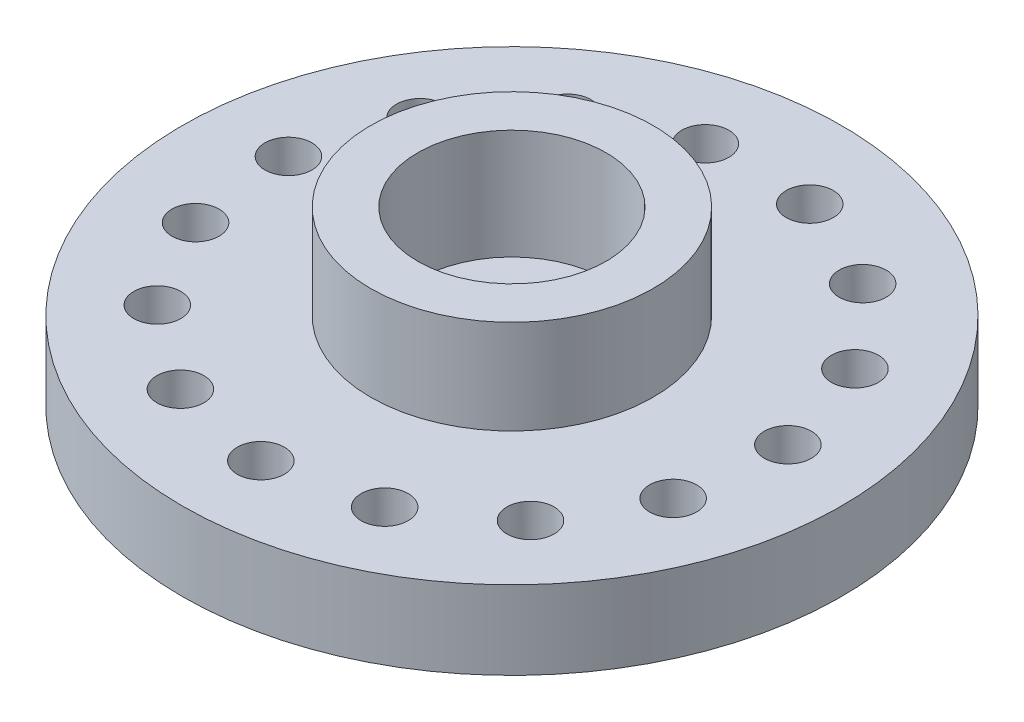
from build123d import *

# Parameters (mm, degrees)
SKETCH_1_R          = 10.5
EXTRUDE_1_DEPTH     = 2.5
SKETCH_2_R          = 4.5
EXTRUDE_2_DEPTH     = 3
SKETCH_3_R          = 3
CUT_EXTRUDE_1_DEPTH = 3.5
SKETCH_4_R          = 0.75
CUT_EXTRUDE_2_DEPTH = 4


with BuildPart() as part:
    # 草图1 → 凸台-拉伸1 (new body)
    with BuildSketch(Plane(origin=(0, 0, 0), x_dir=(1, 0, 0), z_dir=(0, 1, 0))):
        with Locations(Location((0, 0, 0), (0, 0, 270))):
            Circle(SKETCH_1_R)
    extrude(amount=EXTRUDE_1_DEPTH)

    # 草图2 → 凸台-拉伸2 (add)
    with BuildSketch(Plane(origin=(0, 2.5, 0), x_dir=(1, 0, 0), z_dir=(0, 1, 0))):
        with Locations(Location((0, 0, 0), (0, 0, 270))):
            Circle(SKETCH_2_R)
    extrude(amount=EXTRUDE_2_DEPTH)

    # 草图3 → 切除-拉伸1 (cut)
    with BuildSketch(Plane(origin=(0, 5.5, 0), x_dir=(1, 0, 0), z_dir=(0, 1, 0))):
        with Locations(Location((0, 0, 0), (0, 0, 270))):
            Circle(SKETCH_3_R)
    extrude(amount=-CUT_EXTRUDE_1_DEPTH, mode=Mode.SUBTRACT)

    # 草图4 → 切除-拉伸2 (cut)
    with BuildSketch(Plane.XZ):
        with Locations(Location((0, 8, 0), (0, 0, 270))):
            Circle(SKETCH_4_R)
        with Locations(Location((3.253893145, 7.308363661, 0), (0, 0, 270))):
            Circle(SKETCH_4_R)
        with Locations(Location((5.945158604, 5.353044851, 0), (0, 0, 270))):
            Circle(SKETCH_4_R)
        with Locations(Location((7.60845213, 2.472135955, 0), (0, 0, 270))):
            Circle(SKETCH_4_R)
        with Locations(Location((7.956175163, -0.836227706, 0), (0, 0, 270))):
            Circle(SKETCH_4_R)
        with Locations(Location((6.92820323, -4, 0), (0, 0, 270))):
            Circle(SKETCH_4_R)
        with Locations(Location((4.702282018, -6.472135955, 0), (0, 0, 270))):
            Circle(SKETCH_4_R)
        with Locations(Location((1.663293527, -7.825180806, 0), (0, 0, 270))):
            Circle(SKETCH_4_R)
        with Locations(Location((-1.663293527, -7.825180806, 0), (0, 0, 270))):
            Circle(SKETCH_4_R)
        with Locations(Location((-4.702282018, -6.472135955, 0), (0, 0, 270))):
            Circle(SKETCH_4_R)
        with Locations(Location((-6.92820323, -4, 0), (0, 0, 270))):
            Circle(SKETCH_4_R)
        with Locations(Location((-7.956175163, -0.836227706, 0), (0, 0, 270))):
            Circle(SKETCH_4_R)
        with Locations(Location((-7.60845213, 2.472135955, 0), (0, 0, 270))):
            Circle(SKETCH_4_R)
        with Locations(Location((-5.945158604, 5.353044851, 0), (0, 0, 270))):
            Circle(SKETCH_4_R)
        with Locations(Location((-3.253893145, 7.308363661, 0), (0, 0, 270))):
            Circle(SKETCH_4_R)
    extrude(amount=-CUT_EXTRUDE_2_DEPTH, mode=Mode.SUBTRACT)


solid = part.part
